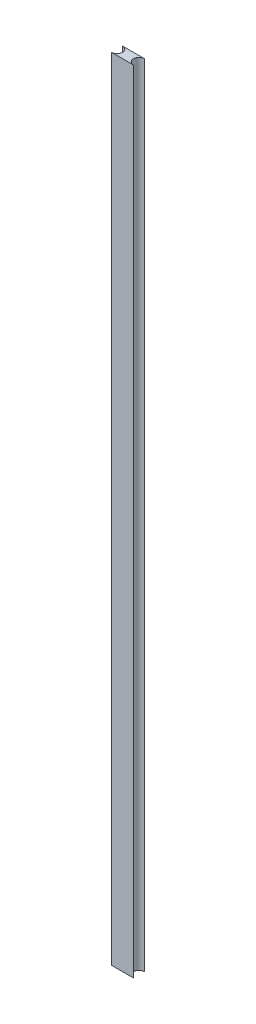
from build123d import *

# Parameters (mm, degrees)
BOSS_EXTRUDE1_DEPTH = 1800


with BuildPart() as part:
    # Sketch1 → Boss-Extrude1 (new body)
    with BuildSketch(Plane(origin=(0, 0, 0), x_dir=(1, 0, 0), z_dir=(0, 1, 0))):
        with BuildLine():
            Line((-44.571687231, -191.639724876), (5.428312769, -191.639724876))
            ThreePointArc((5.428312769, -191.639724876), (-7.071687231, -204.139724876), (5.428312769, -216.639724876))
            Line((5.428312769, -216.639724876), (-44.571687231, -216.639724876))
            ThreePointArc((-44.571687231, -216.639724876), (-32.071687231, -204.139724876), (-44.571687231, -191.639724876))
        make_face()
    extrude(amount=BOSS_EXTRUDE1_DEPTH)


solid = part.part
